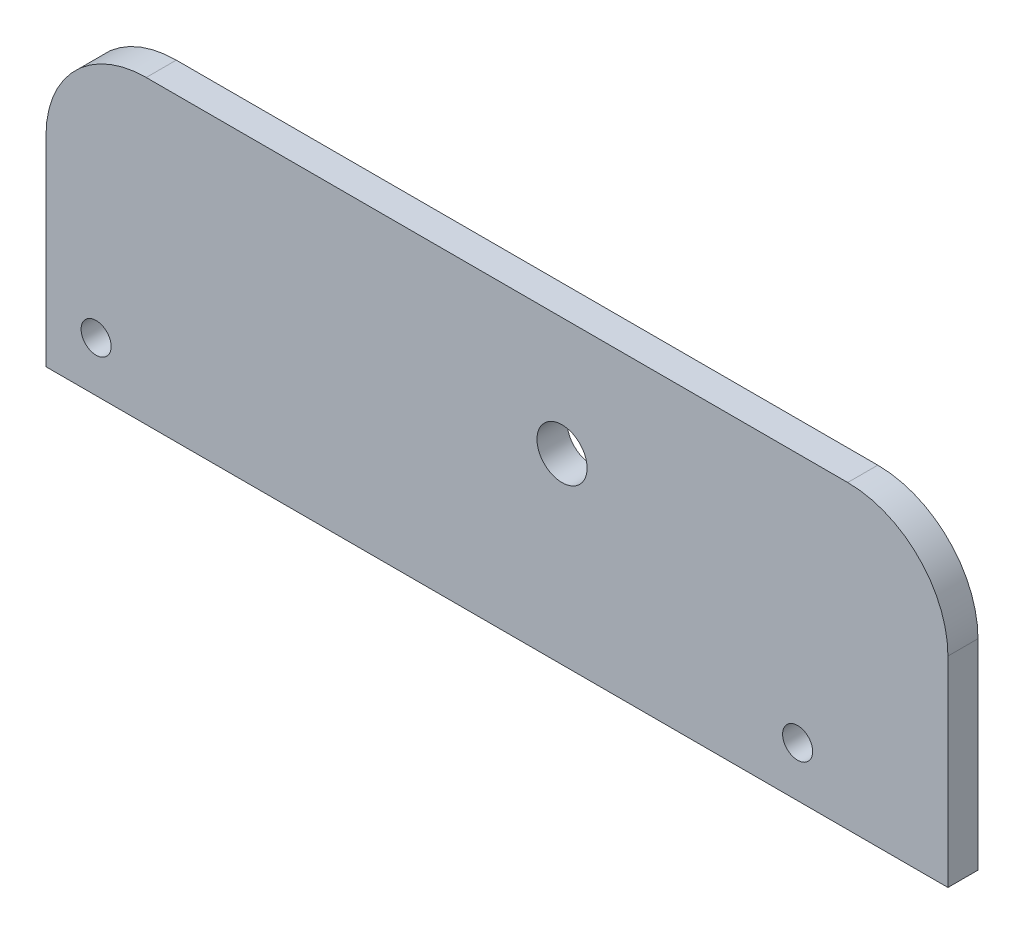
from build123d import *

# Parameters (mm, degrees)
SKETCH_1_W          = 90
SKETCH_1_H          = 30
EXTRUDE_1_DEPTH     = 3
SKETCH_3_R          = 2.5
CUT_EXTRUDE_2_DEPTH = 10
SKETCH_4_R          = 1.5
CUT_EXTRUDE_3_DEPTH = 10
FILLET_1_R          = 10


with BuildPart() as part:
    # 草图1 → 凸台-拉伸1 (new body)
    with BuildSketch(Plane.XY):
        Rectangle(SKETCH_1_W, SKETCH_1_H)
    extrude(amount=EXTRUDE_1_DEPTH)

    # 草图3 → 切除-拉伸2 (cut)
    with BuildSketch(Plane.XY.offset(3)):
        with Locations((6.49227102, 3.236967106)):
            Circle(SKETCH_3_R)
    extrude(amount=-CUT_EXTRUDE_2_DEPTH, mode=Mode.SUBTRACT)

    # 草图4 → 切除-拉伸3 (cut)
    with BuildSketch(Plane.XY.offset(3)):
        with Locations((-40, -10)):
            Circle(SKETCH_4_R)
        with Locations((30, -10)):
            Circle(SKETCH_4_R)
    extrude(amount=-CUT_EXTRUDE_3_DEPTH, mode=Mode.SUBTRACT)

    # 圆角1
    fillet_1_edges = [part.edges().sort_by_distance(p)[0] for p in [
        (-45, 15, 1.5),
        (45, 15, 1.5),
    ]]
    fillet(fillet_1_edges, radius=FILLET_1_R)


solid = part.part
